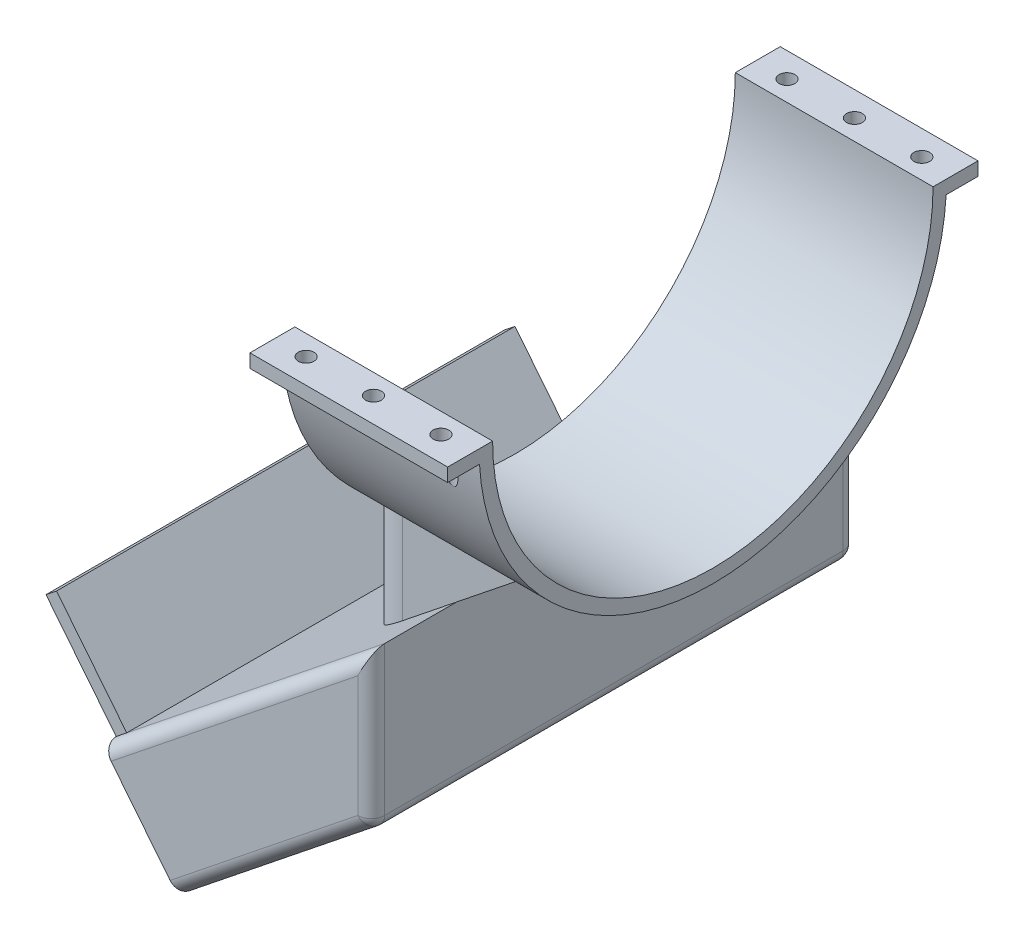
from build123d import *

# Parameters (mm, degrees)
BOSS_EXTRUDE1_DEPTH      = 49
BOSS_EXTRUDE1_DEPTH_BACK = 49
BOSS_EXTRUDE2_DEPTH      = 5
BOSS_EXTRUDE4_DEPTH      = 15
BOSS_EXTRUDE5_DEPTH      = 22
BOSS_EXTRUDE5_DEPTH_BACK = 22
BOSS_EXTRUDE6_REACH      = 127.363
SKETCH7_R                = 1.75
CUT_EXTRUDE1_DEPTH       = 25
SKETCH8_R                = 2.75
CUT_EXTRUDE2_DEPTH       = 25
FILLET1_R                = 10
FILLET2_R                = 3
SKETCH9_W                = 3
SKETCH9_H                = 102
BOSS_EXTRUDE7_DEPTH      = 25


with BuildPart() as part:
    # Sketch1 → Boss-Extrude1 (new, two sides: drawn at the far end of the back side and taken through both)
    with BuildSketch(Plane.XY.offset(-BOSS_EXTRUDE1_DEPTH_BACK)):
        Polygon((0, 0), (50, 40), (50, 20.790627288), (9.370425713, -11.713032142), (13.118595999, -16.398244998), (56, 17.906878203), (56, 52.483749085), (-3.748170285, 4.685212857), align=None)
    extrude(amount=BOSS_EXTRUDE1_DEPTH + BOSS_EXTRUDE1_DEPTH_BACK)

    # Sketch2 → Boss-Extrude2 (add)
    with BuildSketch(Plane.XY.offset(49)):
        Polygon((-3.748170285, 4.685212857), (13.118595999, -16.398244998), (56, 17.906878203), (56, 52.483749085), align=None)
    boss_extrude2 = extrude(amount=BOSS_EXTRUDE2_DEPTH)

    # Mirror1: Boss-Extrude2 across plane
    add(boss_extrude2.mirror(Plane.XY))

    # Sketch4 → Boss-Extrude4 (add)
    with BuildSketch(Plane(origin=(9.370425713, -11.713032142, 0), x_dir=(0.7808688094430303, 0.6246950475544244, 0), z_dir=(-0.6246950475544244, 0.7808688094430304, 0))):
        Polygon((52.031242374, 49), (0, 49), (52.031242374, 44), align=None)
        Polygon((52.031242374, -49), (52.031242374, -44), (0, -49), align=None)
    extrude(amount=BOSS_EXTRUDE4_DEPTH)

    # Sketch5 → Boss-Extrude5 (add, two sides: drawn at the far end of the back side and taken through both)
    with BuildSketch(Plane(origin=(56, 0, 0), x_dir=(0, 0, -1), z_dir=(1, 0, 0)).offset(-BOSS_EXTRUDE5_DEPTH_BACK)):
        with BuildLine():
            Line((-49, 101.483749085), (-59, 101.483749085))
            Line((-59, 101.483749085), (-59, 98.483749085))
            Line((-59, 98.483749085), (-51.91338941, 98.483749085))
            ThreePointArc((-51.91338941, 98.483749085), (0, 49.483749085), (51.91338941, 98.483749085))
            Line((51.91338941, 98.483749085), (59, 98.483749085))
            Line((59, 98.483749085), (59, 101.483749085))
            Line((59, 101.483749085), (49, 101.483749085))
            ThreePointArc((49, 101.483749085), (0, 52.483749085), (-49, 101.483749085))
        make_face()
    extrude(amount=BOSS_EXTRUDE5_DEPTH + BOSS_EXTRUDE5_DEPTH_BACK)

    # Boss-Extrude6: up to this face of the body (flat: up to its plane)
    boss_extrude6_end = Plane(part.part.faces().sort_by_distance((25.735702215, 28.272310857, 0))[0])
    # Sketch6 → Boss-Extrude6 (add, up to the picked face)
    with BuildSketch(Plane.ZY.offset(-34), mode=Mode.PRIVATE) as boss_extrude6_sk1:
        with BuildLine():
            Line((-35, 63.025980039), (-35, 33.025980039))
            Line((-35, 33.025980039), (35, 33.025980039))
            Line((35, 33.025980039), (35, 63.025980039))
            ThreePointArc((35, 63.025980039), (0, 49.483749085), (-35, 63.025980039))
        make_face()
    boss_extrude6_tool1 = split(extrude(boss_extrude6_sk1.sketch, amount=-BOSS_EXTRUDE6_REACH, mode=Mode.PRIVATE), bisect_by=boss_extrude6_end, keep=Keep.BOTH, mode=Mode.PRIVATE)
    add(boss_extrude6_tool1.solids().sort_by(Axis((34, 43.754603, 0), (1, 0, 0)))[0])

    # Sketch7 → Cut-Extrude1 (cut)
    with BuildSketch(Plane(origin=(0, 101.483749085, 0), x_dir=(1, 0, 0), z_dir=(0, 1, 0))):
        with Locations(Location((56, 53.5, 0), (0, 0, 270))):
            Circle(SKETCH7_R)
        with Locations(Location((41, 53.5, 0), (0, 0, 270))):
            Circle(SKETCH7_R)
        with Locations(Location((71, 53.5, 0), (0, 0, 270))):
            Circle(SKETCH7_R)
        with Locations(Location((71, -53.5, 0), (0, 0, 65.044347067))):
            Circle(SKETCH7_R)
        with Locations(Location((56, -53.5, 0), (0, 0, 65.044347067))):
            Circle(SKETCH7_R)
        with Locations(Location((41, -53.5, 0), (0, 0, 65.044347067))):
            Circle(SKETCH7_R)
    extrude(amount=-CUT_EXTRUDE1_DEPTH, mode=Mode.SUBTRACT)

    # Sketch8 → Cut-Extrude2 (cut)
    with BuildSketch(Plane.XZ.offset(-98.483749085)):
        with Locations((41, -53.5)):
            Circle(SKETCH8_R)
        with Locations((56, -53.5)):
            Circle(SKETCH8_R)
        with Locations((71, -53.5)):
            Circle(SKETCH8_R)
        with Locations((71, 53.5)):
            Circle(SKETCH8_R)
        with Locations((56, 53.5)):
            Circle(SKETCH8_R)
        with Locations((41, 53.5)):
            Circle(SKETCH8_R)
    extrude(amount=CUT_EXTRUDE2_DEPTH, mode=Mode.SUBTRACT)

    # Fillet1
    fillet1_edges = [part.edges().sort_by_distance(p)[0] for p in [
        (34, 48.954864562, 35),
        (34, 48.954864562, -35),
    ]]
    fillet(fillet1_edges, radius=FILLET1_R)

    # Fillet2
    fillet2_edges = [part.edges().sort_by_distance(p)[0] for p in [
        (56, 17.906878203, 0),
        (26.125914857, 28.584480971, 54),
        (34.559297999, 0.754316602, 54),
        (56, 35.195313644, 54),
        (26.125914857, 28.584480971, -54),
        (56, 35.195313644, -54),
        (34.559297999, 0.754316602, -54),
    ]]
    fillet(fillet2_edges, radius=FILLET2_R)

    # Sketch9 → Boss-Extrude7 (add)
    with BuildSketch(Plane(origin=(-3.748170285, 4.685212857, 0), x_dir=(0.7808688094430302, 0.6246950475544245, 0), z_dir=(-0.6246950475544245, 0.7808688094430302, 0))):
        with Locations((1.5, 0)):
            Rectangle(SKETCH9_W, SKETCH9_H)
    extrude(amount=BOSS_EXTRUDE7_DEPTH)


solid = part.part
